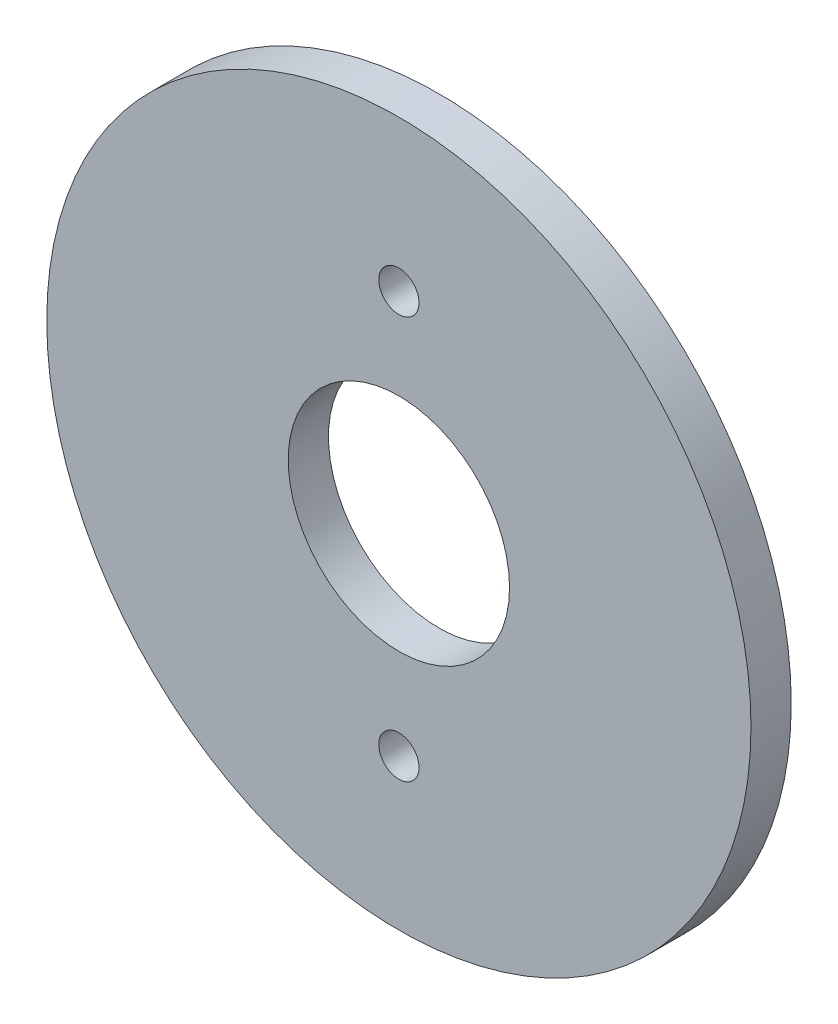
from build123d import *

# Parameters (mm, degrees)
SKETCH_1_R      = 17.5
SKETCH_1_R_2    = 5.5
SKETCH_1_R_3    = 1
EXTRUDE_1_DEPTH = 2


with BuildPart() as part:
    # Эскиз1 → Бобышка-Вытянуть1 (new body)
    with BuildSketch(Plane.XY):
        Circle(SKETCH_1_R)
        Circle(SKETCH_1_R_2, mode=Mode.SUBTRACT)
        with Locations((0, 10)):
            Circle(SKETCH_1_R_3, mode=Mode.SUBTRACT)
        with Locations((0, -10)):
            Circle(SKETCH_1_R_3, mode=Mode.SUBTRACT)
    extrude(amount=EXTRUDE_1_DEPTH)


solid = part.part
